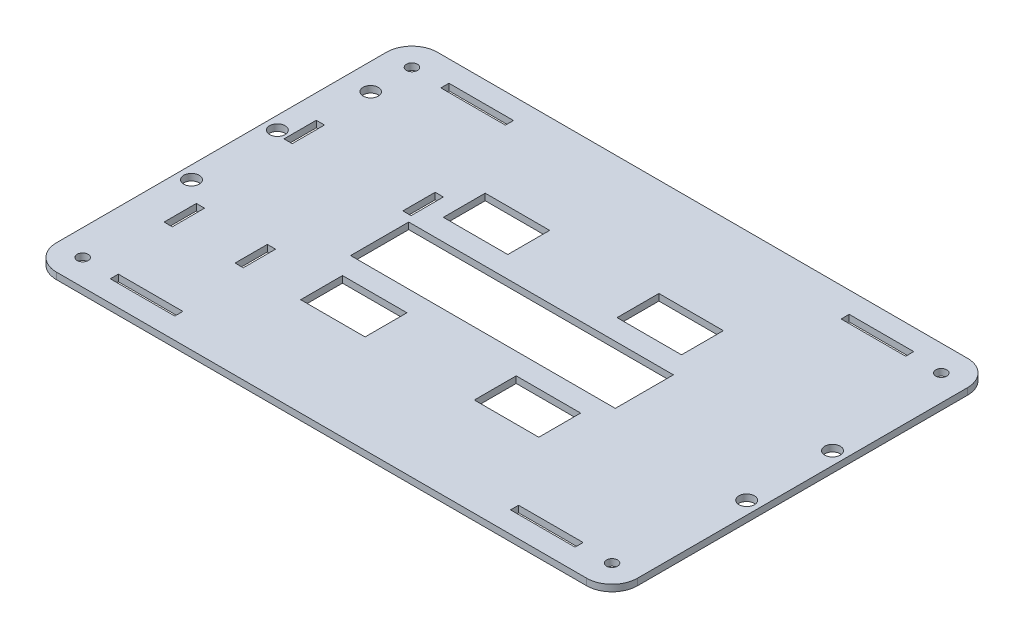
from build123d import *

# Parameters (mm, degrees)
SKETCH1_W           = 228.6
SKETCH1_H           = 149.86
SKETCH1_R           = 3.05
SKETCH1_R_2         = 2.159
SKETCH1_W_2         = 25.4
SKETCH1_H_2         = 3.175
BOSS_EXTRUDE1_DEPTH = 2.6
FILLET1_R           = 10
SKETCH25_W          = 104.14
SKETCH25_H          = 22.86
SKETCH25_W_2        = 3.2385
SKETCH25_H_2        = 12.7
CUT_EXTRUDE18_DEPTH = 10.16
SKETCH26_W          = 25.35893358
SKETCH26_H          = 16.469313419
CUT_EXTRUDE19_DEPTH = 7.62
SKETCH27_R          = 3
CUT_EXTRUDE20_DEPTH = 7.62


with BuildPart() as part:
    # Sketch1 → Boss-Extrude1 (new body)
    with BuildSketch(Plane(origin=(0, 0, 0), x_dir=(1, 0, 0), z_dir=(0, 1, 0))):
        with Locations((114.3, -74.93)):
            Rectangle(SKETCH1_W, SKETCH1_H)
        with Locations(Location((5.08, -58.039, 0), (0, 0, 270))):
            Circle(SKETCH1_R, mode=Mode.SUBTRACT)
        with Locations(Location((5.08, -91.821, 0), (0, 0, 270))):
            Circle(SKETCH1_R, mode=Mode.SUBTRACT)
        with Locations(Location((223.52, -91.821, 0), (0, 0, 270))):
            Circle(SKETCH1_R, mode=Mode.SUBTRACT)
        with Locations(Location((223.52, -58.039, 0), (0, 0, 270))):
            Circle(SKETCH1_R, mode=Mode.SUBTRACT)
        with Locations(Location((218.44, -10.16, 0), (0, 0, 270))):
            Circle(SKETCH1_R_2, mode=Mode.SUBTRACT)
        with Locations(Location((10.16, -10.16, 0), (0, 0, 270))):
            Circle(SKETCH1_R_2, mode=Mode.SUBTRACT)
        with Locations(Location((218.44, -139.7, 0), (0, 0, 270))):
            Circle(SKETCH1_R_2, mode=Mode.SUBTRACT)
        with Locations(Location((10.16, -139.7, 0), (0, 0, 270))):
            Circle(SKETCH1_R_2, mode=Mode.SUBTRACT)
        with Locations((35.56, -9.887961988)):
            Rectangle(SKETCH1_W_2, SKETCH1_H_2, mode=Mode.SUBTRACT)
        with Locations((193.04, -9.887961988)):
            Rectangle(SKETCH1_W_2, SKETCH1_H_2, mode=Mode.SUBTRACT)
        with Locations((193.04, -139.972038012)):
            Rectangle(SKETCH1_W_2, SKETCH1_H_2, mode=Mode.SUBTRACT)
        with Locations((35.56, -139.972038012)):
            Rectangle(SKETCH1_W_2, SKETCH1_H_2, mode=Mode.SUBTRACT)
    extrude(amount=BOSS_EXTRUDE1_DEPTH)

    # Fillet1
    fillet1_edges = [part.edges().sort_by_distance(p)[0] for p in [
        (0, 1.3, 0),
        (228.6, 1.3, 0),
        (228.6, 1.3, 149.86),
        (0, 1.3, 149.86),
    ]]
    fillet(fillet1_edges, radius=FILLET1_R)

    # Sketch25 → Cut-Extrude18 (cut)
    with BuildSketch(Plane(origin=(0, 2.6, 0), x_dir=(1, 0, 0), z_dir=(0, 1, 0))):
        with Locations((114.3, -74.93)):
            Rectangle(SKETCH25_W, SKETCH25_H)
        with Locations((10.991446919, -53.364023976)):
            Rectangle(SKETCH25_W_2, SKETCH25_H_2)
        with Locations((58.908546919, -54.507023976)):
            Rectangle(SKETCH25_W_2, SKETCH25_H_2)
        with Locations((15.741246919, -105.294323976)):
            Rectangle(SKETCH25_W_2, SKETCH25_H_2)
        with Locations((43.668546919, -105.294323976)):
            Rectangle(SKETCH25_W_2, SKETCH25_H_2)
    extrude(amount=-CUT_EXTRUDE18_DEPTH, mode=Mode.SUBTRACT)

    # Sketch26 → Cut-Extrude19 (cut)
    with BuildSketch(Plane(origin=(0, 2.6, 0), x_dir=(1, 0, 0), z_dir=(0, 1, 0))):
        with Locations((80.126817751, -46.853769114)):
            Rectangle(SKETCH26_W, SKETCH26_H)
        with Locations((80.126817751, -103.006230887)):
            Rectangle(SKETCH26_W, SKETCH26_H)
        with Locations((148.473182249, -103.006230887)):
            Rectangle(SKETCH26_W, SKETCH26_H)
        with Locations((148.473182249, -46.853769114)):
            Rectangle(SKETCH26_W, SKETCH26_H)
    extrude(amount=-CUT_EXTRUDE19_DEPTH, mode=Mode.SUBTRACT)

    # Sketch27 → Cut-Extrude20 (cut)
    with BuildSketch(Plane(origin=(0, 2.6, 0), x_dir=(1, 0, 0), z_dir=(0, 1, 0))):
        with Locations(Location((10.356901739, -26.58723359, 0), (0, 0, 270))):
            Circle(SKETCH27_R)
    extrude(amount=-CUT_EXTRUDE20_DEPTH, mode=Mode.SUBTRACT)


solid = part.part
